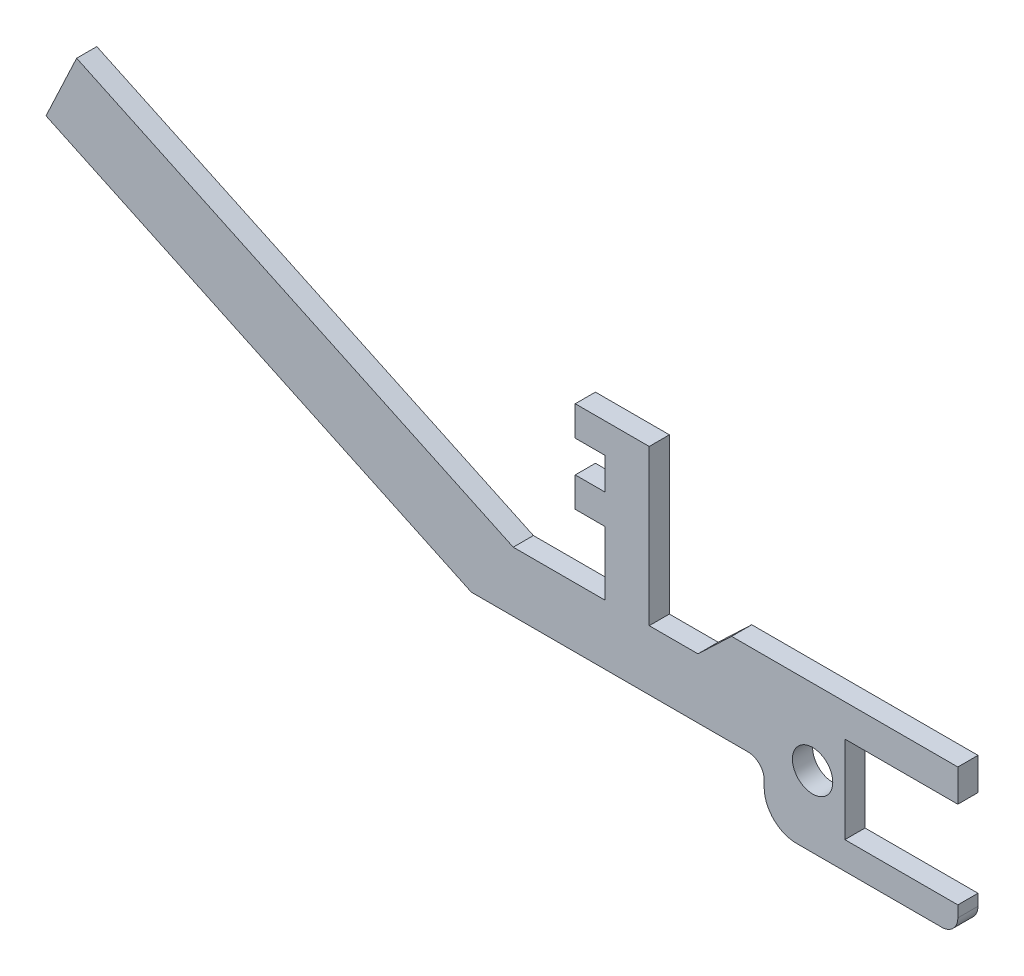
from build123d import *

# Parameters (mm, degrees)
SKETCH1_R           = 1.5875
BOSS_EXTRUDE1_DEPTH = 1.5875


with BuildPart() as part:
    # Sketch1 → Boss-Extrude1 (new body)
    with BuildSketch(Plane.XY):
        with BuildLine():
            Line((-16.325816956, 3.455164033), (-23.558913278, 3.455164033))
            Line((-23.558913278, 3.455164033), (-57.919477855, 19.600489558))
            Line((-57.919477855, 19.600489558), (-60.33041288, 14.469525274))
            Line((-60.33041288, 14.469525274), (-26.855616668, -1.259595838))
            Line((-26.855616668, -1.259595838), (-5.08, -1.259595838))
            ThreePointArc((-5.08, -1.259595838), (-4.181974388, -1.631570226), (-3.81, -2.529595838))
            Line((-3.81, -2.529595838), (-3.81, -3.048))
            ThreePointArc((-3.81, -3.048), (-3.066051224, -4.844051224), (-1.27, -5.588))
            Line((-1.27, -5.588), (10.16, -5.588))
            ThreePointArc((10.16, -5.588), (11.058025612, -5.216025612), (11.43, -4.318))
            Line((11.43, -4.318), (11.43, -3.429))
            Line((11.43, -3.429), (2.54, -3.429))
            Line((2.54, -3.429), (2.54, 3.429))
            Line((2.54, 3.429), (11.43, 3.429))
            Line((11.43, 3.429), (11.43, 5.969))
            Line((11.43, 5.969), (-6.374321652, 5.969))
            Line((-6.374321652, 5.969), (-9.020464775, 3.455164033))
            Line((-9.020464775, 3.455164033), (-12.857372303, 3.455164033))
            Line((-12.857372303, 3.455164033), (-12.857372303, 15.672353851))
            Line((-12.857372303, 15.672353851), (-18.678887174, 15.672353851))
            Line((-18.678887174, 15.672353851), (-18.678887174, 13.324716524))
            Line((-18.678887174, 13.324716524), (-16.325816956, 13.324716524))
            Line((-16.325816956, 13.324716524), (-16.325816956, 10.822176612))
            Line((-16.325816956, 10.822176612), (-18.678887174, 10.822176612))
            Line((-18.678887174, 10.822176612), (-18.678887174, 8.474539284))
            Line((-18.678887174, 8.474539284), (-16.325816956, 8.474539284))
            Line((-16.325816956, 8.474539284), (-16.325816956, 3.455164033))
        make_face()
        Circle(SKETCH1_R, mode=Mode.SUBTRACT)
    extrude(amount=BOSS_EXTRUDE1_DEPTH)


solid = part.part
